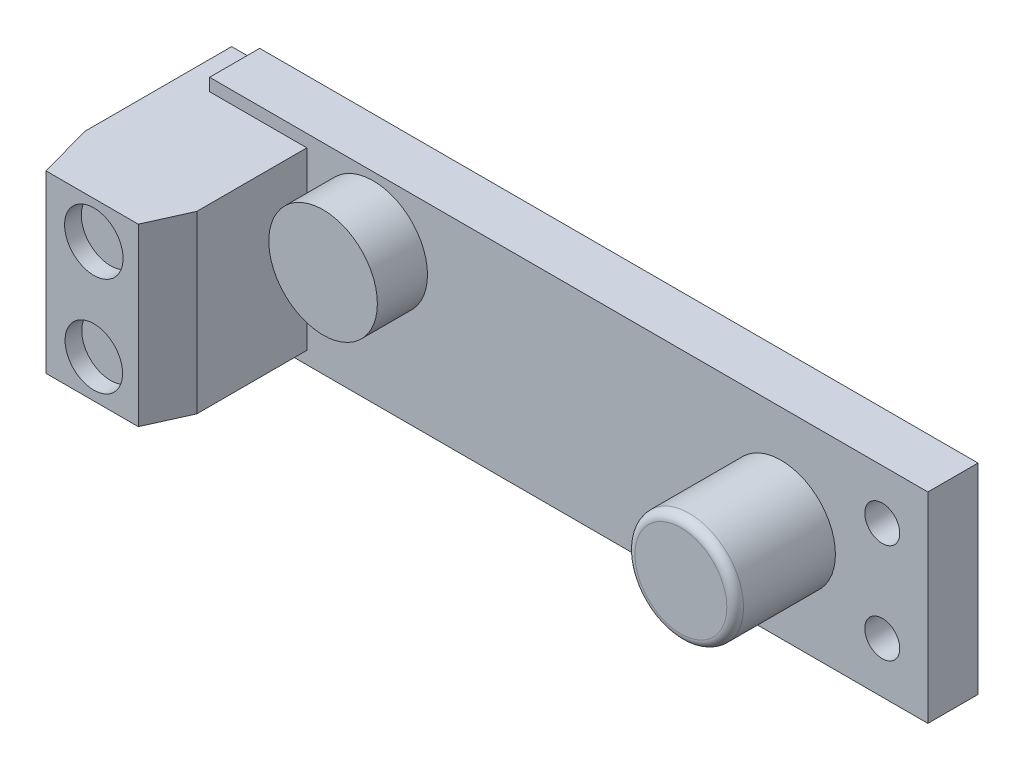
from build123d import *

# Parameters (mm, degrees)
ESQUISSE1_R                  = 1.047730405
ESQUISSE1_R_2                = 3.25
BOSS_EXTRU_1_DEPTH           = 3
BOSS_EXTRU_2_DEPTH           = 3
BOSS_EXTRU_2_DEPTH_BACK      = 3
ESQUISSE1_3_R                = 3.25
BOSS_EXTRU_3_DEPTH           = 6
BOSS_EXTRU_3_DEPTH_BACK      = 3
ESQUISSE1_4_R                = 3.25
BOSS_EXTRU_4_DEPTH           = 9
BOSS_EXTRU_4_DEPTH_BACK      = 3
ESQUISSE1_5_W                = 7.5
ESQUISSE1_5_H                = 10.5
ESQUISSE1_5_R                = 1.751165812
ESQUISSE1_5_R_2              = 1.722458175
BOSS_EXTRU_5_DEPTH           = 8
BOSS_EXTRU_5_DEPTH_BACK      = 3
ESQUISSE1_6_R                = 1.751165812
ESQUISSE1_6_R_2              = 1.722458175
ENL_V_MAT_EXTRU_1_DEPTH      = 8
ENL_V_MAT_EXTRU_1_DEPTH_BACK = 8
CONG_1_R                     = 0.5


with BuildPart() as part:
    # Esquisse1 → Boss.-Extru.1 (new body)
    with BuildSketch(Plane.XY):
        Polygon((-21.5, -5.25), (-21.5, -6), (21.5, -6), (21.5, 6), (-21.5, 6), (-21.5, 5.25), (-15.680696028, 5.25), (-15.680696028, -5.25), align=None)
        with Locations((18.767939295, -2.963429097)):
            Circle(ESQUISSE1_R, mode=Mode.SUBTRACT)
        with Locations((-11.706099573, 2.280487387)):
            Circle(ESQUISSE1_R_2, mode=Mode.SUBTRACT)
        with Locations((12.713644898, 0)):
            Circle(ESQUISSE1_R_2, mode=Mode.SUBTRACT)
        with Locations((18.767939295, 3.012819582)):
            Circle(ESQUISSE1_R, mode=Mode.SUBTRACT)
    extrude(amount=-BOSS_EXTRU_1_DEPTH)

    # Esquisse1<3> → Boss.-Extru.2 (add, two sides: drawn at the far end of the back side and taken through both)
    with BuildSketch(Plane.XY.offset(-BOSS_EXTRU_2_DEPTH_BACK)):
        with Locations((-11.706099573, 2.280487387)):
            Circle(ESQUISSE1_3_R)
    extrude(amount=BOSS_EXTRU_2_DEPTH + BOSS_EXTRU_2_DEPTH_BACK)

    # Esquisse1<4> → Boss.-Extru.3 (add, two sides: drawn at the far end of the back side and taken through both)
    with BuildSketch(Plane.XY.offset(-BOSS_EXTRU_3_DEPTH_BACK)):
        with Locations((12.713644898, 0)):
            Circle(ESQUISSE1_4_R)
    extrude(amount=BOSS_EXTRU_3_DEPTH + BOSS_EXTRU_3_DEPTH_BACK)

    # Esquisse1<5> → Boss.-Extru.4 (add, two sides: drawn at the far end of the back side and taken through both)
    with BuildSketch(Plane.XY.offset(-BOSS_EXTRU_4_DEPTH_BACK)):
        with Locations((-19.430696028, 0)):
            Rectangle(ESQUISSE1_5_W, ESQUISSE1_5_H)
        with Locations((-19.430696028, 3.012819582)):
            Circle(ESQUISSE1_5_R, mode=Mode.SUBTRACT)
        with Locations((-19.430696028, -2.963429097)):
            Circle(ESQUISSE1_5_R_2, mode=Mode.SUBTRACT)
    extrude(amount=BOSS_EXTRU_4_DEPTH + BOSS_EXTRU_4_DEPTH_BACK)

    # Esquisse1<6> → Boss.-Extru.5 (add, two sides: drawn at the far end of the back side and taken through both)
    with BuildSketch(Plane.XY.offset(-BOSS_EXTRU_5_DEPTH_BACK)):
        with Locations((-19.430696028, 3.012819582)):
            Circle(ESQUISSE1_6_R)
        with Locations((-19.430696028, -2.963429097)):
            Circle(ESQUISSE1_6_R_2)
    extrude(amount=BOSS_EXTRU_5_DEPTH + BOSS_EXTRU_5_DEPTH_BACK)

    # Esquisse2 → Enlèv. mat.-Extru.1 (cut, two sides: drawn at the far end of the back side and taken through both)
    with BuildSketch(Plane(origin=(0, 0, 0), x_dir=(1, 0, 0), z_dir=(0, 1, 0)).offset(-ENL_V_MAT_EXTRU_1_DEPTH_BACK)):
        Polygon((-23.180696028, -5.790746035), (-22.293736237, -9), (-23.180696028, -9), align=None)
        Polygon((-15.680696028, -6.586297382), (-16.769074106, -9), (-15.680696028, -9), align=None)
    extrude(amount=ENL_V_MAT_EXTRU_1_DEPTH + ENL_V_MAT_EXTRU_1_DEPTH_BACK, mode=Mode.SUBTRACT)

    # Congé1
    cong_1_edges = [part.edges().sort_by_distance(p)[0] for p in [
        (9.463644898, 0, 6),
    ]]
    fillet(cong_1_edges, radius=CONG_1_R)


solid = part.part
